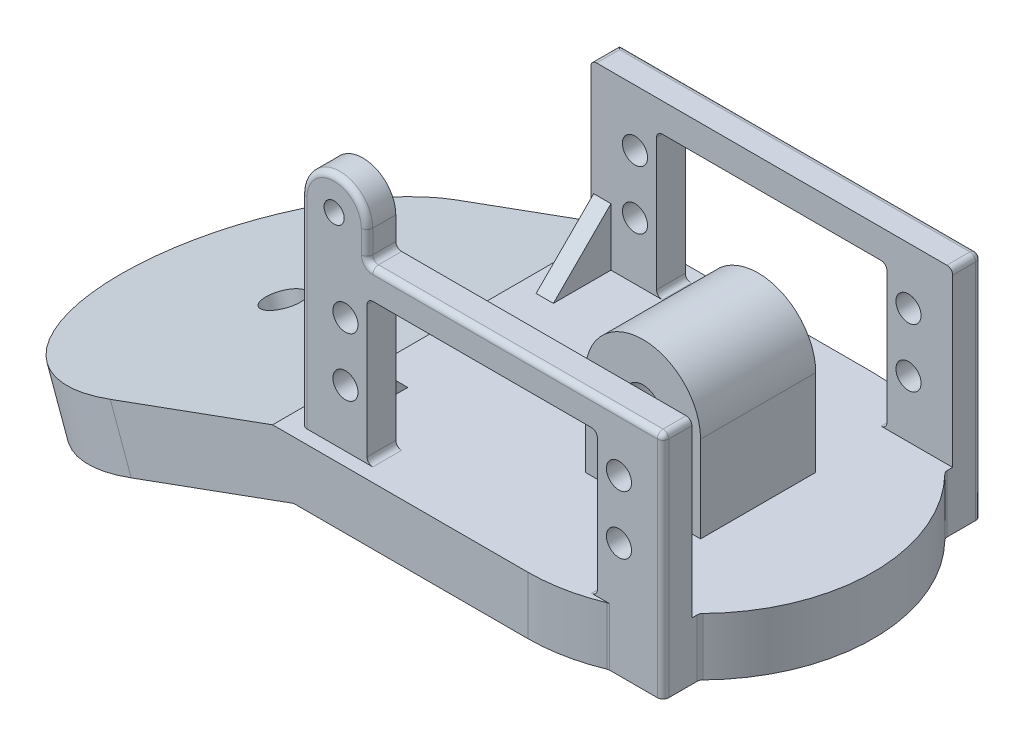
from build123d import *

# Parameters (mm, degrees)
BOSS_EXTRU_3_DEPTH      = 5
ESQUISSE7_R             = 3.175
BOSS_EXTRU_5_DEPTH      = 10
ESQUISSE13_R            = 2.18
BOSS_EXTRU_8_DEPTH      = 5
ESQUISSE33_W            = 9.466792894
ESQUISSE33_H            = 55.28
BOSS_EXTRU_10_DEPTH     = 10
ENL_V_MAT_EXTRU_6_DEPTH = 65
ESQUISSE35_R            = 30
BOSS_EXTRU_11_DEPTH     = 5.32
BOSS_EXTRU_12_DEPTH     = 30
ESQUISSE41_R            = 3.175
ENL_V_MAT_EXTRU_7_DEPTH = 60
ESQUISSE42_R            = 1.75
BOSS_EXTRU_13_DEPTH     = 5
NERVURE4_REACH          = 90.538
ESQUISSE45_WALL_W       = 193.218913386
ESQUISSE45_WALL_H       = 3
CONG_1_R                = 1
CONG_2_R                = 1


with BuildPart() as part:
    # Esquisse5 → Boss.-Extru.3 (new, symmetric)
    with BuildSketch(Plane(origin=(0, 0, 0), x_dir=(1, 0, 0), z_dir=(0, 1, 0))):
        with BuildLine():
            Line((42.5, -30), (-42.5, -30))
            ThreePointArc((-42.5, -30), (-72.5, 0), (-42.5, 30))
            Line((-42.5, 30), (42.5, 30))
            ThreePointArc((42.5, 30), (72.5, 0), (42.5, -30))
        make_face()
    extrude(amount=BOSS_EXTRU_3_DEPTH, both=True)

    # Esquisse7 → Boss.-Extru.5 (add, symmetric)
    with BuildSketch(Plane.XY):
        with BuildLine():
            Line((32.5, 5), (52.5, 5))
            Line((52.5, 5), (52.5, 20))
            ThreePointArc((52.5, 20), (42.5, 30), (32.5, 20))
            Line((32.5, 20), (32.5, 5))
        make_face()
        with Locations((42.5, 20)):
            Circle(ESQUISSE7_R, mode=Mode.SUBTRACT)
    extrude(amount=BOSS_EXTRU_5_DEPTH, both=True)

    # Esquisse13 → Boss.-Extru.8 (add)
    with BuildSketch(Plane.XY.offset(22.64)):
        Polygon((0.8, 5), (5.8, 5), (12.215, 5), (12.215, 29.91), (52.215, 29.91), (52.215, 5), (58.63, 5), (63.63, 5), (63.63, 34.91), (0.8, 34.91), align=None)
        with Locations((8.47, 14.92)):
            Circle(ESQUISSE13_R, mode=Mode.SUBTRACT)
        with Locations((55.97, 14.92)):
            Circle(ESQUISSE13_R, mode=Mode.SUBTRACT)
        with Locations((8.47, 25.08)):
            Circle(ESQUISSE13_R, mode=Mode.SUBTRACT)
        with Locations((55.97, 25.08)):
            Circle(ESQUISSE13_R, mode=Mode.SUBTRACT)
    boss_extru_8 = extrude(amount=BOSS_EXTRU_8_DEPTH)

    # Symétrie2: Boss.-Extru.8 across plane
    add(boss_extru_8.mirror(Plane.XY))

    # Esquisse33 → Boss.-Extru.10 (add)
    with BuildSketch(Plane.XZ.offset(-5)):
        with Locations((58.896603553, 0)):
            Rectangle(ESQUISSE33_W, ESQUISSE33_H)
    extrude(amount=BOSS_EXTRU_10_DEPTH)

    # Esquisse36 → Enlèv. mat.-Extru.6 (cut, symmetric)
    with BuildSketch(Plane.XY):
        Polygon((0, 0), (9.099255857, -25), (-112.5, -25), (-112.5, 35), (-12.738958199, 35), align=None)
    extrude(amount=ENL_V_MAT_EXTRU_6_DEPTH, both=True, mode=Mode.SUBTRACT)



with BuildPart() as body_2:
    # Esquisse35 → Boss.-Extru.11 (new, symmetric)
    with BuildSketch(Plane(origin=(0, 0, 0), x_dir=(0, 0, -1), z_dir=(-0.34202014332566977, 0.939692620785908, 0))):
        with Locations(Location((0, 30, 0), (0, 0, 90))):
            Circle(ESQUISSE35_R)
    extrude(amount=BOSS_EXTRU_11_DEPTH, both=True)


with BuildPart() as part_1:
    add(part.part)

    add(body_2.part)  # Boss.-Extru.12 merges body 2
    # Esquisse40 → Boss.-Extru.12 (add, symmetric)
    with BuildSketch(Plane.XY):
        Polygon((-26.371231461, -15.259769042), (-30.010325786, -5.261439557), (-1.819547162, 4.999164743), (1.819547162, -4.999164743), align=None)
    extrude(amount=BOSS_EXTRU_12_DEPTH, both=True)

    # Esquisse41 → Enlèv. mat.-Extru.7 (cut)
    with BuildSketch(Plane(origin=(-1.819547162, 4.999164743, 0), x_dir=(0.939692620785908, 0.3420201433256698, 0), z_dir=(-0.3420201433256698, 0.9396926207859081, 0))):
        with Locations(Location((-30, 0, 0), (0, 0, 180))):
            Circle(ESQUISSE41_R)
    extrude(amount=-ENL_V_MAT_EXTRU_7_DEPTH, mode=Mode.SUBTRACT)

    # Esquisse42 → Boss.-Extru.13 (add)
    with BuildSketch(Plane.XY.offset(27.64)):
        with BuildLine():
            Line((0.8, 39.91), (0.8, 34.91))
            Line((0.8, 34.91), (12.215, 34.91))
            Line((12.215, 34.91), (12.215, 39.91))
            ThreePointArc((12.215, 39.91), (6.5075, 45.6175), (0.8, 39.91))
        make_face()
        with Locations((6.5075, 39.91)):
            Circle(ESQUISSE42_R, mode=Mode.SUBTRACT)
    extrude(amount=-BOSS_EXTRU_13_DEPTH)

    # Esquisse45 wall → Nervure4 (add, up to next)
    with BuildSketch(Plane(origin=(2.8, 9.999582371, 17.640000004), x_dir=(0, -0.707106781505, -0.707106780868), z_dir=(0, -0.707106780868, 0.707106781505)), mode=Mode.PRIVATE) as nervure4_sk1:
        Rectangle(ESQUISSE45_WALL_W, ESQUISSE45_WALL_H)
    nervure4_tool1 = extrude(nervure4_sk1.sketch, amount=NERVURE4_REACH, mode=Mode.PRIVATE) - part_1.part
    nervure4 = nervure4_tool1.solids().sort_by_distance((2.8, 9.999582371, 17.640000004))[0]
    add(nervure4)

    # Congé1
    cong_1_edges = [part_1.edges().sort_by_distance(p)[0] for p in [
        (54.163207106, 0, 27.64),
        (63.63, 14.955, 27.64),
        (63.63, 0, 21.296081799),
        (63.63, 0, -21.296081799),
        (63.63, 14.955, -27.64),
        (54.163207106, 0, -27.64),
    ]]
    fillet(cong_1_edges, radius=CONG_1_R)

    # Symétrie3: Nervure4 across plane
    add(nervure4.mirror(Plane.XY))

    # Congé2
    cong_2_edges = [part_1.edges().sort_by_distance(p)[0] for p in [
        (63.63, 34.91, 24.64),
        (63.63, 34.91, -24.64),
        (52.215, 5, 25.14),
        (12.215, 5, -25.14),
        (12.215, 29.91, 25.14),
        (52.215, 29.91, 25.14),
        (0.8, 22.455, 27.64),
        (12.215, 5, 25.14),
        (52.215, 29.91, -25.14),
        (12.215, 29.91, -25.14),
        (0.8, 34.91, -25.14),
        (52.215, 5, -25.14),
        (31.715, 34.91, -27.64),
        (37.4225, 34.91, 27.64),
        (6.5075, 45.6175, 27.64),
        (12.215, 34.91, 25.14),
        (12.215, 37.41, 27.64),
        (63.337106781, 34.91, 27.347106781),
        (63.337106781, 34.91, -27.347106781),
    ]]
    fillet(cong_2_edges, radius=CONG_2_R)


solid = part_1.part
